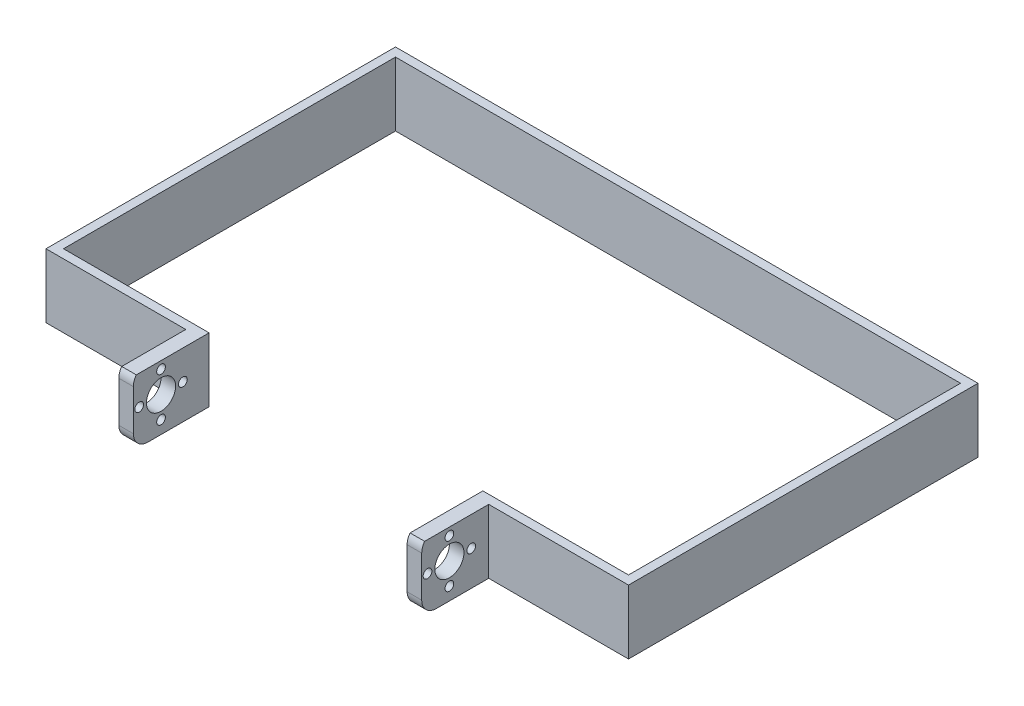
from build123d import *

# Parameters (mm, degrees)
SKETCH_1_W               = 104
SKETCH_1_H               = 40
SKETCH_1_R               = 5
SKETCH_1_R_2             = 1.5
EXTRUDE_1_DEPTH          = 3
SKETCH_2_W               = 5
SKETCH_2_H               = 40
EXTRUDE_2_DEPTH          = 20
CUT_EXTRUDE_1_DEPTH      = 111.431414635
CUT_EXTRUDE_1_DEPTH_BACK = 111.431414635
SKETCH_3_R               = 1.5
SKETCH_3_R_2             = 5
FILLET_1_R               = 10
SKETCH_4_W               = 200
SKETCH_4_H               = 40
EXTRUDE_3_DEPTH          = 100
CUT_EXTRUDE_2_DEPTH      = 100
CUT_EXTRUDE_3_DEPTH      = 185.266376038
CUT_EXTRUDE_3_DEPTH_BACK = 185.266376038
FILLET_2_R               = 5
CUT_EXTRUDE_4_DEPTH      = 226.499661516
CUT_EXTRUDE_4_DEPTH_BACK = 226.499661516
CUT_EXTRUDE_5_DEPTH      = 225.605419664
CUT_EXTRUDE_5_DEPTH_BACK = 225.605419664
SKETCH_8_W               = 135.335857316
SKETCH_8_H               = 8.120151439
SKETCH_9_W               = 20
SKETCH_9_H               = 22
EXTRUDE_4_DEPTH          = 200
CUT_EXTRUDE_6_DEPTH      = 168.657388896
CUT_EXTRUDE_6_DEPTH_BACK = 168.657388896
SKETCH_10_W              = 194
SKETCH_10_H              = 20


with BuildPart() as part:
    # 草图1 → 凸台-拉伸1 (new body)
    with BuildSketch(Plane.XY):
        with Locations((15, 9.156428763)):
            Rectangle(SKETCH_1_W, SKETCH_1_H)
        with Locations((15, 9.156428763)):
            Circle(SKETCH_1_R, mode=Mode.SUBTRACT)
        with Locations((15, 16.656428763)):
            Circle(SKETCH_1_R_2, mode=Mode.SUBTRACT)
        with Locations((22.5, 9.156428763)):
            Circle(SKETCH_1_R_2, mode=Mode.SUBTRACT)
        with Locations((15, 1.656428763)):
            Circle(SKETCH_1_R_2, mode=Mode.SUBTRACT)
        with Locations((7.5, 9.156428763)):
            Circle(SKETCH_1_R_2, mode=Mode.SUBTRACT)
    extrude(amount=EXTRUDE_1_DEPTH)

    # 草图2 → 凸台-拉伸2 (add)
    with BuildSketch(Plane.XY.offset(3)):
        with Locations((-34.5, 9.156428763)):
            Rectangle(SKETCH_2_W, SKETCH_2_H)
        with Locations((64.5, 9.156428763)):
            Rectangle(SKETCH_2_W, SKETCH_2_H)
    extrude(amount=EXTRUDE_2_DEPTH)

    # 草图3 → 切除-拉伸1 (cut, two sides: drawn at the far end of the back side and taken through both)
    with BuildSketch(Plane(origin=(67, 0, 0), x_dir=(0, 0, -1), z_dir=(1, 0, 0)).offset(-CUT_EXTRUDE_1_DEPTH_BACK)):
        with Locations(Location((-13.5, 16.569068444, 0), (0, 0, 90))):
            Circle(SKETCH_3_R)
        with Locations(Location((-13.5, 1.569068444, 0), (0, 0, 90))):
            Circle(SKETCH_3_R)
        with Locations(Location((-13.5, 9.069068444, 0), (0, 0, 90))):
            Circle(SKETCH_3_R_2)
        with Locations(Location((-6, 9.069068444, 0), (0, 0, 90))):
            Circle(SKETCH_3_R)
        with Locations(Location((-21, 9.069068444, 0), (0, 0, 90))):
            Circle(SKETCH_3_R)
    extrude(amount=CUT_EXTRUDE_1_DEPTH + CUT_EXTRUDE_1_DEPTH_BACK, mode=Mode.SUBTRACT)

    # 圆角1
    fillet_1_edges = [part.edges().sort_by_distance(p)[0] for p in [
        (-34.5, 29.156428763, 23),
        (-34.5, -10.843571237, 23),
        (64.5, 29.156428763, 23),
        (64.5, -10.843571237, 23),
    ]]
    fillet(fillet_1_edges, radius=FILLET_1_R)

    # 草图4 → 凸台-拉伸3 (add)
    with BuildSketch(Plane(origin=(0, 0, 0), x_dir=(-1, 0, 0), z_dir=(0, 0, -1))):
        with Locations((-15, 9.156428763)):
            Rectangle(SKETCH_4_W, SKETCH_4_H)
    extrude(amount=EXTRUDE_3_DEPTH)

    # 草图5 → 切除-拉伸2 (cut)
    with BuildSketch(Plane(origin=(0, 29.156428763, 0), x_dir=(1, 0, 0), z_dir=(0, 1, 0))):
        Polygon((112, 97), (-82, 97), (-82, 3), (-32, 3), (-32, -3), (62, -3), (62, 3), (112, 3), align=None)
    extrude(amount=-CUT_EXTRUDE_2_DEPTH, mode=Mode.SUBTRACT)

    # 草图6 → 切除-拉伸3 (cut, two sides: drawn at the far end of the back side and taken through both)
    with BuildSketch(Plane.ZY.offset(37).offset(-CUT_EXTRUDE_3_DEPTH_BACK)):
        Polygon((0, 21.156428763), (22.797958971, 21.156428763), (26.883028225, 31.204196531), (0, 34.707184858), align=None)
        Polygon((0, -2.843571237), (22.797958971, -2.843571237), (28.320151641, -11.460404888), (0, -17.388538979), align=None)
    extrude(amount=CUT_EXTRUDE_3_DEPTH + CUT_EXTRUDE_3_DEPTH_BACK, mode=Mode.SUBTRACT)

    # 圆角2
    fillet_2_edges = [part.edges().sort_by_distance(p)[0] for p in [
        (-34.5, -2.843571237, 22.797958971),
        (-34.5, 21.156428763, 22.797958971),
        (64.5, -2.843571237, 22.797958971),
        (64.5, 21.156428763, 22.797958971),
    ]]
    fillet(fillet_2_edges, radius=FILLET_2_R)

    # 草图7 → 切除-拉伸4 (cut, two sides: drawn at the far end of the back side and taken through both)
    with BuildSketch(Plane.ZY.offset(85).offset(-CUT_EXTRUDE_4_DEPTH_BACK)):
        Polygon((0, 21.156428763), (-100, 21.156428763), (-112.355284076, 36.746993881), (4.033553215, 41.186010001), align=None)
        Polygon((-100, -2.843571237), (0, -2.843571237), (4.033553215, -17.712155102), (-111.164328532, -19.119648018), align=None)
    extrude(amount=CUT_EXTRUDE_4_DEPTH + CUT_EXTRUDE_4_DEPTH_BACK, mode=Mode.SUBTRACT)

    # 草图8 → 切除-拉伸5 (cut, two sides: drawn at the far end of the back side and taken through both)
    with BuildSketch(Plane.ZY.offset(85).offset(-CUT_EXTRUDE_5_DEPTH_BACK)):
        with Locations((-37.649890838, 23.216504482)):
            Rectangle(SKETCH_8_W, SKETCH_8_H)
    extrude(amount=CUT_EXTRUDE_5_DEPTH + CUT_EXTRUDE_5_DEPTH_BACK, mode=Mode.SUBTRACT)

    # 草图9 → 凸台-拉伸4 (add)
    with BuildSketch(Plane.ZY.offset(85)):
        with Locations((-110, 8.156428763)):
            Rectangle(SKETCH_9_W, SKETCH_9_H)
    extrude(amount=-EXTRUDE_4_DEPTH)

    # 草图10 → 切除-拉伸6 (cut, two sides: drawn at the far end of the back side and taken through both)
    with BuildSketch(Plane(origin=(0, 19.156428763, 0), x_dir=(1, 0, 0), z_dir=(0, 1, 0)).offset(-CUT_EXTRUDE_6_DEPTH_BACK)):
        with Locations((15, 107)):
            Rectangle(SKETCH_10_W, SKETCH_10_H)
    extrude(amount=CUT_EXTRUDE_6_DEPTH + CUT_EXTRUDE_6_DEPTH_BACK, mode=Mode.SUBTRACT)


solid = part.part
